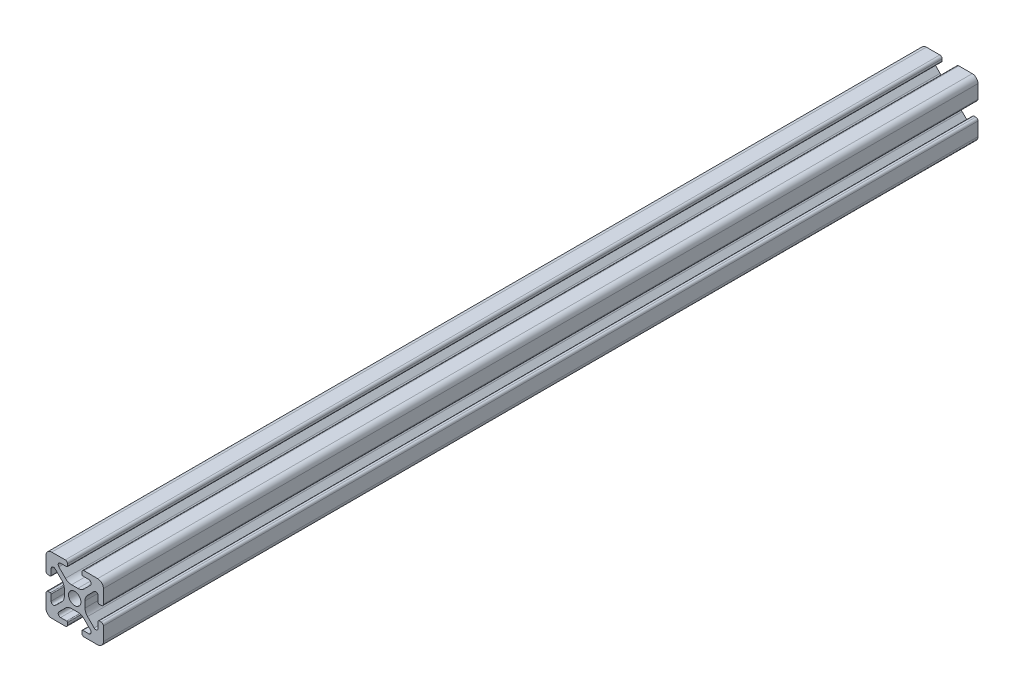
from build123d import *

# Parameters (mm, degrees)
BOSS_EXTRUDE1_DEPTH      = 152.4
BOSS_EXTRUDE1_DEPTH_BACK = 152.4
SKETCH3_R                = 2.15


with BuildPart() as part:
    # Sketch3 → Boss-Extrude1 (new, two sides: drawn at the far end of the back side and taken through both)
    with BuildSketch(Plane.XY.offset(-BOSS_EXTRUDE1_DEPTH_BACK)):
        with BuildLine():
            Line((3.2874, 10), (8, 10))
            ThreePointArc((8, 10), (9.414213562, 9.414213562), (10, 8))
            Line((10, 8), (10, 3.2874))
            ThreePointArc((10, 3.2874), (9.76937588, 2.73062412), (9.2126, 2.5))
            Line((9.2126, 2.5), (8.5048, 2.5))
            ThreePointArc((8.5048, 2.5), (8.289273853, 2.589273853), (8.2, 2.8048))
            Line((8.2, 2.8048), (8.2, 4.9118))
            ThreePointArc((8.2, 4.9118), (7.682565253, 5.686195824), (6.769103096, 5.504496904))
            Line((6.769103096, 5.504496904), (4.478679656, 3.214073464))
            ThreePointArc((4.478679656, 3.214073464), (3.828361402, 2.240803418), (3.6, 1.092753121))
            Line((3.6, 1.092753121), (3.6, -1.092753121))
            ThreePointArc((3.6, -1.092753121), (3.828361402, -2.240803418), (4.478679656, -3.214073464))
            Line((4.478679656, -3.214073464), (6.769103096, -5.504496904))
            ThreePointArc((6.769103096, -5.504496904), (7.682565253, -5.686195824), (8.2, -4.9118))
            Line((8.2, -4.9118), (8.2, -2.8048))
            ThreePointArc((8.2, -2.8048), (8.289273853, -2.589273853), (8.5048, -2.5))
            Line((8.5048, -2.5), (9.2126, -2.5))
            ThreePointArc((9.2126, -2.5), (9.76937588, -2.73062412), (10, -3.2874))
            Line((10, -3.2874), (10, -8))
            ThreePointArc((10, -8), (9.414213562, -9.414213562), (8, -10))
            Line((8, -10), (3.2874, -10))
            ThreePointArc((3.2874, -10), (2.73062412, -9.76937588), (2.5, -9.2126))
            Line((2.5, -9.2126), (2.5, -8.5048))
            ThreePointArc((2.5, -8.5048), (2.589273853, -8.289273853), (2.8048, -8.2))
            Line((2.8048, -8.2), (4.9118, -8.2))
            ThreePointArc((4.9118, -8.2), (5.686195824, -7.682565253), (5.504496904, -6.769103096))
            Line((5.504496904, -6.769103096), (3.214073464, -4.478679656))
            ThreePointArc((3.214073464, -4.478679656), (2.240803418, -3.828361402), (1.092753121, -3.6))
            Line((1.092753121, -3.6), (-1.092753121, -3.6))
            ThreePointArc((-1.092753121, -3.6), (-2.240803418, -3.828361402), (-3.214073464, -4.478679656))
            Line((-3.214073464, -4.478679656), (-5.504496904, -6.769103096))
            ThreePointArc((-5.504496904, -6.769103096), (-5.686195824, -7.682565253), (-4.9118, -8.2))
            Line((-4.9118, -8.2), (-2.8048, -8.2))
            ThreePointArc((-2.8048, -8.2), (-2.589273853, -8.289273853), (-2.5, -8.5048))
            Line((-2.5, -8.5048), (-2.5, -9.2126))
            ThreePointArc((-2.5, -9.2126), (-2.73062412, -9.76937588), (-3.2874, -10))
            Line((-3.2874, -10), (-8, -10))
            ThreePointArc((-8, -10), (-9.414213562, -9.414213562), (-10, -8))
            Line((-10, -8), (-10, -3.2874))
            ThreePointArc((-10, -3.2874), (-9.76937588, -2.73062412), (-9.2126, -2.5))
            Line((-9.2126, -2.5), (-8.5048, -2.5))
            ThreePointArc((-8.5048, -2.5), (-8.289273853, -2.589273853), (-8.2, -2.8048))
            Line((-8.2, -2.8048), (-8.2, -4.9118))
            ThreePointArc((-8.2, -4.9118), (-7.682565253, -5.686195824), (-6.769103096, -5.504496904))
            Line((-6.769103096, -5.504496904), (-4.478679656, -3.214073464))
            ThreePointArc((-4.478679656, -3.214073464), (-3.828361402, -2.240803418), (-3.6, -1.092753121))
            Line((-3.6, -1.092753121), (-3.6, 1.092753121))
            ThreePointArc((-3.6, 1.092753121), (-3.828361402, 2.240803418), (-4.478679656, 3.214073464))
            Line((-4.478679656, 3.214073464), (-6.769103096, 5.504496904))
            ThreePointArc((-6.769103096, 5.504496904), (-7.682565253, 5.686195824), (-8.2, 4.9118))
            Line((-8.2, 4.9118), (-8.2, 2.8048))
            ThreePointArc((-8.2, 2.8048), (-8.289273853, 2.589273853), (-8.5048, 2.5))
            Line((-8.5048, 2.5), (-9.2126, 2.5))
            ThreePointArc((-9.2126, 2.5), (-9.76937588, 2.73062412), (-10, 3.2874))
            Line((-10, 3.2874), (-10, 8))
            ThreePointArc((-10, 8), (-9.414213562, 9.414213562), (-8, 10))
            Line((-8, 10), (-3.2874, 10))
            ThreePointArc((-3.2874, 10), (-2.73062412, 9.76937588), (-2.5, 9.2126))
            Line((-2.5, 9.2126), (-2.5, 8.5048))
            ThreePointArc((-2.5, 8.5048), (-2.589273853, 8.289273853), (-2.8048, 8.2))
            Line((-2.8048, 8.2), (-4.9118, 8.2))
            ThreePointArc((-4.9118, 8.2), (-5.686195824, 7.682565253), (-5.504496904, 6.769103096))
            Line((-5.504496904, 6.769103096), (-3.214073464, 4.478679656))
            ThreePointArc((-3.214073464, 4.478679656), (-2.240803418, 3.828361402), (-1.092753121, 3.6))
            Line((-1.092753121, 3.6), (1.092753121, 3.6))
            ThreePointArc((1.092753121, 3.6), (2.240803418, 3.828361402), (3.214073464, 4.478679656))
            Line((3.214073464, 4.478679656), (5.504496904, 6.769103096))
            ThreePointArc((5.504496904, 6.769103096), (5.686195824, 7.682565253), (4.9118, 8.2))
            Line((4.9118, 8.2), (2.8048, 8.2))
            ThreePointArc((2.8048, 8.2), (2.589273853, 8.289273853), (2.5, 8.5048))
            Line((2.5, 8.5048), (2.5, 9.2126))
            ThreePointArc((2.5, 9.2126), (2.73062412, 9.76937588), (3.2874, 10))
        make_face()
        with Locations(Location((0, 0, 0), (0, 0, 180))):
            Circle(SKETCH3_R, mode=Mode.SUBTRACT)
    extrude(amount=BOSS_EXTRUDE1_DEPTH + BOSS_EXTRUDE1_DEPTH_BACK)


solid = part.part
